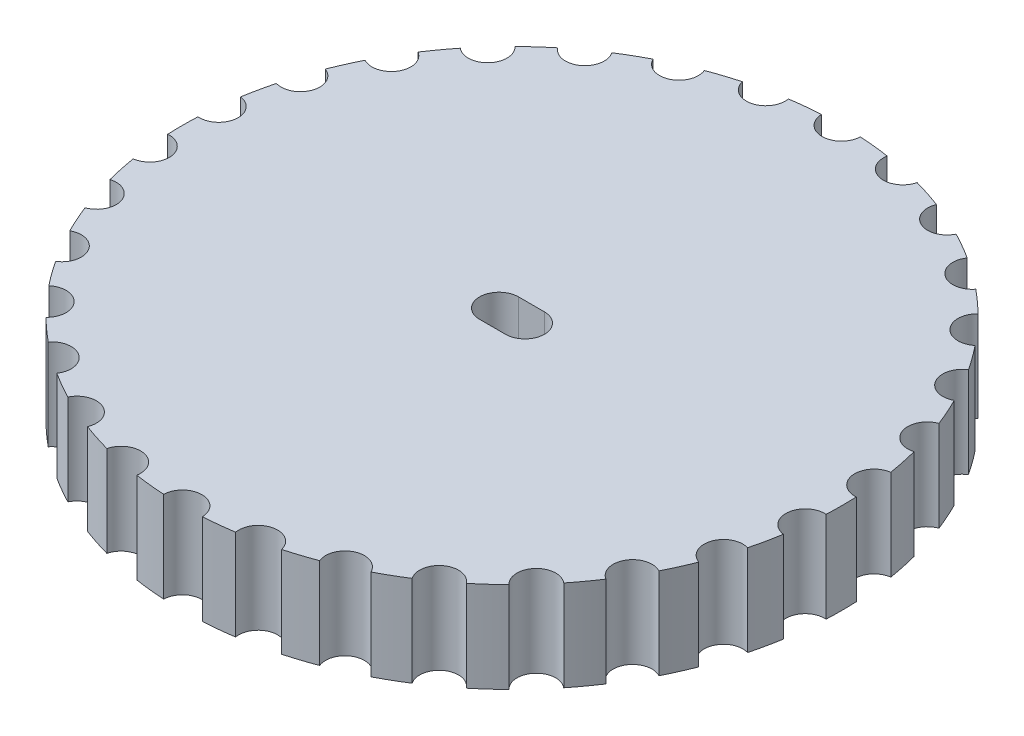
from build123d import *

# Parameters (mm, degrees)
SKETCH1_R           = 25.4
BOSS_EXTRUDE1_DEPTH = 7
CUT_EXTRUDE1_DEPTH  = 6
SKETCH4_R           = 1.496602071
CUT_EXTRUDE2_DEPTH  = 37.596721165


with BuildPart() as part:
    # Sketch1 → Boss-Extrude1 (new body)
    with BuildSketch(Plane(origin=(0, 0, 0), x_dir=(1, 0, 0), z_dir=(0, 1, 0))):
        with Locations(Location((0, 0, 0), (0, 0, 270))):
            Circle(SKETCH1_R)
    extrude(amount=BOSS_EXTRUDE1_DEPTH)

    # Sketch3 → Cut-Extrude1 (cut)
    with BuildSketch(Plane(origin=(0, 7, 0), x_dir=(1, 0, 0), z_dir=(0, 1, 0))):
        with BuildLine():
            Line((-1, 1.5), (1, 1.5))
            ThreePointArc((1, 1.5), (2.5, 0), (1, -1.5))
            Line((1, -1.5), (-1, -1.5))
            ThreePointArc((-1, -1.5), (-2.5, 0), (-1, 1.5))
        make_face()
    extrude(amount=-CUT_EXTRUDE1_DEPTH, mode=Mode.SUBTRACT)

    # Sketch4 → Cut-Extrude2 (cut, through all)
    with BuildSketch(Plane(origin=(0, 7, 0), x_dir=(1, 0, 0), z_dir=(0, 1, 0))):
        with Locations((0, 25.4)):
            Circle(SKETCH4_R)
        with Locations((5.280956947, 24.844949059)):
            Circle(SKETCH4_R)
        with Locations((10.331110734, 23.204054624)):
            Circle(SKETCH4_R)
        with Locations((14.929745408, 20.549031657)):
            Circle(SKETCH4_R)
        with Locations((18.875878567, 16.995917402)):
            Circle(SKETCH4_R)
        with Locations((21.997045256, 12.7)):
            Circle(SKETCH4_R)
        with Locations((24.156835514, 7.849031657)):
            Circle(SKETCH4_R)
        with Locations((25.260856142, 2.655022967)):
            Circle(SKETCH4_R)
        with Locations((25.260856142, -2.655022967)):
            Circle(SKETCH4_R)
        with Locations((24.156835514, -7.849031657)):
            Circle(SKETCH4_R)
        with Locations((21.997045256, -12.7)):
            Circle(SKETCH4_R)
        with Locations((18.875878567, -16.995917402)):
            Circle(SKETCH4_R)
        with Locations((14.929745408, -20.549031657)):
            Circle(SKETCH4_R)
        with Locations((10.331110734, -23.204054624)):
            Circle(SKETCH4_R)
        with Locations((5.280956947, -24.844949059)):
            Circle(SKETCH4_R)
        with Locations((0, -25.4)):
            Circle(SKETCH4_R)
        with Locations((-5.280956947, -24.844949059)):
            Circle(SKETCH4_R)
        with Locations((-10.331110734, -23.204054624)):
            Circle(SKETCH4_R)
        with Locations((-14.929745408, -20.549031657)):
            Circle(SKETCH4_R)
        with Locations((-18.875878567, -16.995917402)):
            Circle(SKETCH4_R)
        with Locations((-21.997045256, -12.7)):
            Circle(SKETCH4_R)
        with Locations((-24.156835514, -7.849031657)):
            Circle(SKETCH4_R)
        with Locations((-25.260856142, -2.655022967)):
            Circle(SKETCH4_R)
        with Locations((-25.260856142, 2.655022967)):
            Circle(SKETCH4_R)
        with Locations((-24.156835514, 7.849031657)):
            Circle(SKETCH4_R)
        with Locations((-21.997045256, 12.7)):
            Circle(SKETCH4_R)
        with Locations((-18.875878567, 16.995917402)):
            Circle(SKETCH4_R)
        with Locations((-14.929745408, 20.549031657)):
            Circle(SKETCH4_R)
        with Locations((-10.331110734, 23.204054624)):
            Circle(SKETCH4_R)
        with Locations((-5.280956947, 24.844949059)):
            Circle(SKETCH4_R)
    extrude(amount=-CUT_EXTRUDE2_DEPTH, mode=Mode.SUBTRACT)


solid = part.part
